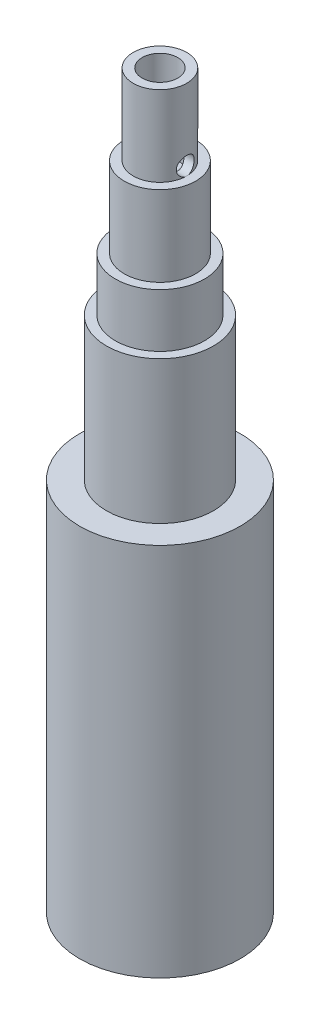
from build123d import *

# Parameters (mm, degrees)
SKETCH1_R                      = 9
BASE_SECTION_DEPTH             = 42
SKETCH2_R                      = 6
SECOND_SECTION_DEPTH           = 16
SKETCH3_R                      = 5
BEARING_SECTION_DEPTH          = 6
SKETCH4_R                      = 4
SEAL_SECTION_DEPTH             = 9
SKETCH5_R                      = 3
IMPELLER_SECTION_DEPTH         = 9
SKETCH6_R                      = 2
IMPELLER_SCREW_HOLE_DEPTH      = 10
SKETCH7_R                      = 4
MOTOR_SHAFT_HOLE_DEPTH         = 32
IMPELLER_DOWEL_HOLE_DEPTH      = 10
IMPELLER_DOWEL_HOLE_DEPTH_BACK = 10
SKETCH8_R                      = 1
SKETCH9_R                      = 3
SET_SCREW_HOLES_DEPTH          = 20


with BuildPart() as part:
    # Sketch1 → base section (new body)
    with BuildSketch(Plane(origin=(0, 0, 0), x_dir=(1, 0, 0), z_dir=(0, 1, 0))):
        Circle(SKETCH1_R)
    extrude(amount=BASE_SECTION_DEPTH)

    # Sketch2 → second section (add)
    with BuildSketch(Plane(origin=(0, 42, 0), x_dir=(1, 0, 0), z_dir=(0, 1, 0))):
        Circle(SKETCH2_R)
    extrude(amount=SECOND_SECTION_DEPTH)

    # Sketch3 → bearing section (add)
    with BuildSketch(Plane(origin=(0, 58, 0), x_dir=(1, 0, 0), z_dir=(0, 1, 0))):
        Circle(SKETCH3_R)
    extrude(amount=BEARING_SECTION_DEPTH)

    # Sketch4 → seal section (add)
    with BuildSketch(Plane(origin=(0, 64, 0), x_dir=(1, 0, 0), z_dir=(0, 1, 0))):
        Circle(SKETCH4_R)
    extrude(amount=SEAL_SECTION_DEPTH)

    # Sketch5 → impeller section (add)
    with BuildSketch(Plane(origin=(0, 73, 0), x_dir=(1, 0, 0), z_dir=(0, 1, 0))):
        Circle(SKETCH5_R)
    extrude(amount=IMPELLER_SECTION_DEPTH)

    # Sketch6 → impeller screw hole (cut)
    with BuildSketch(Plane(origin=(0, 82, 0), x_dir=(1, 0, 0), z_dir=(0, 1, 0))):
        Circle(SKETCH6_R)
    extrude(amount=-IMPELLER_SCREW_HOLE_DEPTH, mode=Mode.SUBTRACT)

    # Sketch7 → motor shaft hole (cut)
    with BuildSketch(Plane(origin=(0, 0, 0), x_dir=(-1, 0, 0), z_dir=(0, -1, 0))):
        Circle(SKETCH7_R)
    extrude(amount=-MOTOR_SHAFT_HOLE_DEPTH, mode=Mode.SUBTRACT)

    # Sketch8 → impeller dowel hole (cut, two sides: drawn at the far end of the back side and taken through both)
    with BuildSketch(Plane(origin=(0, 0, 0), x_dir=(0, 0, -1), z_dir=(1, 0, 0)).offset(-IMPELLER_DOWEL_HOLE_DEPTH_BACK)):
        with Locations((0, 74)):
            Circle(SKETCH8_R)
    extrude(amount=IMPELLER_DOWEL_HOLE_DEPTH + IMPELLER_DOWEL_HOLE_DEPTH_BACK, mode=Mode.SUBTRACT)

    # Sketch9 → set screw holes (cut)
    with BuildSketch(Plane(origin=(0, 0, 0), x_dir=(0, 0, -1), z_dir=(1, 0, 0))):
        with Locations((0, 29)):
            Circle(SKETCH9_R)
        with Locations((0, 18.333333333)):
            Circle(SKETCH9_R)
    extrude(amount=-SET_SCREW_HOLES_DEPTH, mode=Mode.SUBTRACT)


solid = part.part
